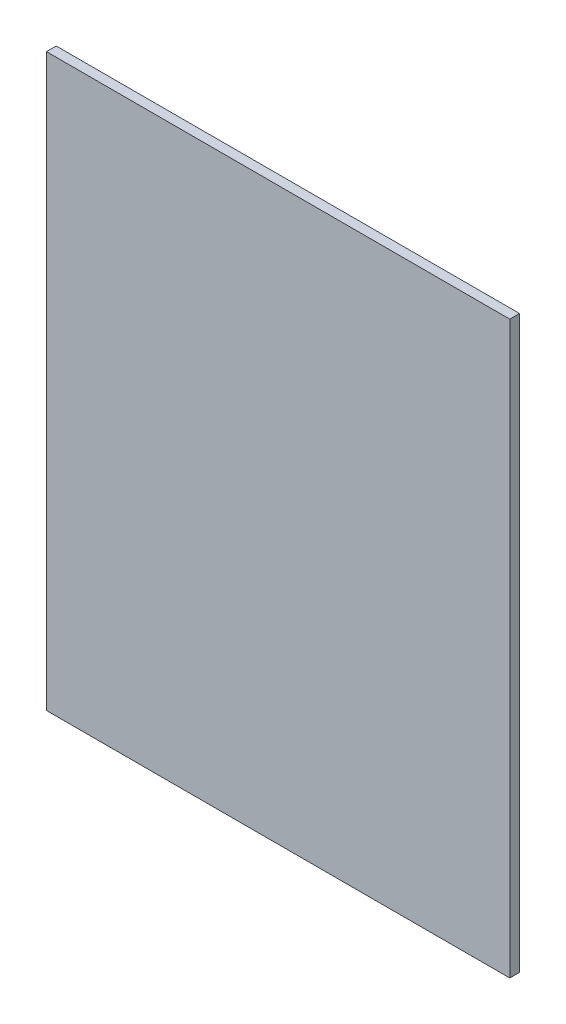
from build123d import *

# Parameters (mm, degrees)
SKETCH1_W           = 380
SKETCH1_H           = 468
BOSS_EXTRUDE1_DEPTH = 8


with BuildPart() as part:
    # Sketch1 → Boss-Extrude1 (new body)
    with BuildSketch(Plane.XY):
        Rectangle(SKETCH1_W, SKETCH1_H)
    extrude(amount=BOSS_EXTRUDE1_DEPTH)


solid = part.part
